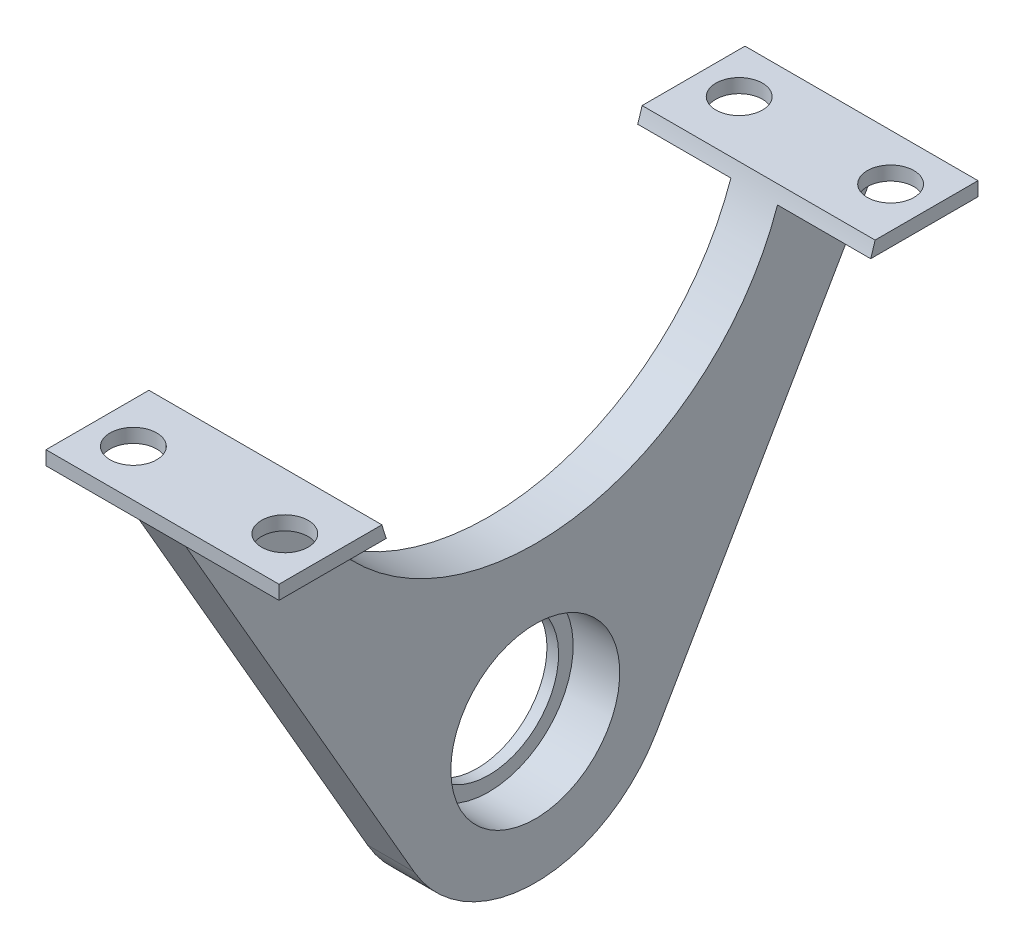
from build123d import *

# Parameters (mm, degrees)
EXTRUDE_1_DEPTH          = 60
CUT_EXTRUDE_1_DEPTH      = 40
CUT_EXTRUDE_1_DEPTH_BACK = 40
SKETCH_2_R               = 7.25
SKETCH_3_R               = 8
SKETCH_3_R_2             = 6
EXTRUDE_2_DEPTH          = 1
CUT_EXTRUDE_2_REACH      = 75.103
SKETCH_4_R               = 2


with BuildPart() as part:
    # 草图1 → 凸台-拉伸1 (new body)
    with BuildSketch(Plane.XY):
        Polygon((0, 0), (0, 40), (8, 40), (8, 41.2), (-12, 41.2), (-12, 40), (-4, 40), (-4, 0), align=None)
    extrude(amount=EXTRUDE_1_DEPTH)

    # 草图2 → 切除-拉伸1 (cut, two sides: drawn at the far end of the back side and taken through both)
    with BuildSketch(Plane(origin=(0, 0, 0), x_dir=(0, 0, -1), z_dir=(1, 0, 0)).offset(-CUT_EXTRUDE_1_DEPTH_BACK)):
        with BuildLine():
            ThreePointArc((-19.604755263, 6.005094925), (-23.997453078, 1.609166037), (-30, 0))
            Line((-30, 0), (0, 0))
            Line((0, 0), (0, 40))
            Line((0, 40), (-19.604755263, 6.005094925))
        make_face()
        with BuildLine():
            Line((-40.395244737, 6.005094925), (-60, 40))
            Line((-60, 40), (-60, 0))
            Line((-60, 0), (-30, 0))
            ThreePointArc((-30, 0), (-36.002546922, 1.609166037), (-40.395244737, 6.005094925))
        make_face()
        with Locations(Location((-30, 12, 0), (0, 0, 180))):
            Circle(SKETCH_2_R)
        with BuildLine():
            Line((-51.166010489, 41.2), (-8.833989511, 41.2))
            ThreePointArc((-8.833989511, 41.2), (-30, 25.2), (-51.166010489, 41.2))
        make_face()
    extrude(amount=CUT_EXTRUDE_1_DEPTH + CUT_EXTRUDE_1_DEPTH_BACK, mode=Mode.SUBTRACT)

    # 草图3 → 凸台-拉伸2 (add)
    with BuildSketch(Plane.ZY.offset(4)):
        with Locations(Location((30, 12, 0), (0, 0, 90))):
            Circle(SKETCH_3_R)
        with Locations(Location((30, 12, 0), (0, 0, 270))):
            Circle(SKETCH_3_R_2, mode=Mode.SUBTRACT)
    extrude(amount=EXTRUDE_2_DEPTH)

    # 草图4 → 切除-拉伸2 (cut, up to next)
    with BuildSketch(Plane.XZ.offset(-40), mode=Mode.PRIVATE) as cut_extrude_2_sk1:
        with Locations((-8.5, 4)):
            Circle(SKETCH_4_R)
    cut_extrude_2_tool1 = extrude(cut_extrude_2_sk1.sketch, amount=-CUT_EXTRUDE_2_REACH, mode=Mode.PRIVATE) & part.part
    # 草图4 → 切除-拉伸2 (cut, up to next)
    with BuildSketch(Plane.XZ.offset(-40), mode=Mode.PRIVATE) as cut_extrude_2_sk2:
        with Locations((4.5, 4)):
            Circle(SKETCH_4_R)
    cut_extrude_2_tool2 = extrude(cut_extrude_2_sk2.sketch, amount=-CUT_EXTRUDE_2_REACH, mode=Mode.PRIVATE) & part.part
    # 草图4 → 切除-拉伸2 (cut, up to next)
    with BuildSketch(Plane.XZ.offset(-40), mode=Mode.PRIVATE) as cut_extrude_2_sk3:
        with Locations((-8.5, 56)):
            Circle(SKETCH_4_R)
    cut_extrude_2_tool3 = extrude(cut_extrude_2_sk3.sketch, amount=-CUT_EXTRUDE_2_REACH, mode=Mode.PRIVATE) & part.part
    # 草图4 → 切除-拉伸2 (cut, up to next)
    with BuildSketch(Plane.XZ.offset(-40), mode=Mode.PRIVATE) as cut_extrude_2_sk4:
        with Locations((4.5, 56)):
            Circle(SKETCH_4_R)
    cut_extrude_2_tool4 = extrude(cut_extrude_2_sk4.sketch, amount=-CUT_EXTRUDE_2_REACH, mode=Mode.PRIVATE) & part.part
    add(cut_extrude_2_tool1.solids().sort_by_distance((-8.5, 40, 4))[0], mode=Mode.SUBTRACT)
    add(cut_extrude_2_tool2.solids().sort_by_distance((4.5, 40, 4))[0], mode=Mode.SUBTRACT)
    add(cut_extrude_2_tool3.solids().sort_by_distance((-8.5, 40, 56))[0], mode=Mode.SUBTRACT)
    add(cut_extrude_2_tool4.solids().sort_by_distance((4.5, 40, 56))[0], mode=Mode.SUBTRACT)


solid = part.part
